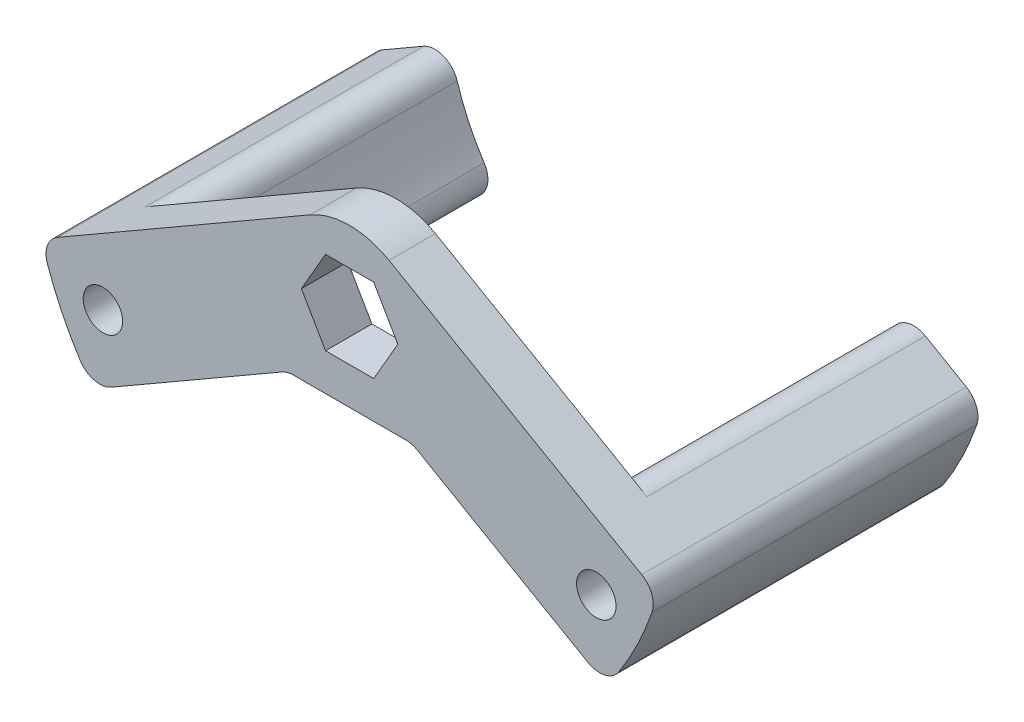
from build123d import *

# Parameters (mm, degrees)
PLATE_DEPTH  = 1
PILLAR_START = -7
PILLAR_DEPTH = 7
CUT_DEPTH    = 12.862454801607791
HOLESKE_R    = 0.4249999999999999
HOLE_DEPTH   = 11.491832758845009
FILLET_2_R   = 0.5


with BuildPart() as part:
    # PlateSke → Plate (new body)
    with BuildSketch(Plane.XY):
        with BuildLine():
            Line((-4.829949748426477, -0.8255818721816728), (-0.8500000000000022, 1.472243186433545))
            ThreePointArc((-0.8500000000000022, 1.472243186433545), (1e-16, 1.7000000000000004), (0.8500000000000022, 1.472243186433545))
            Line((0.8500000000000022, 1.472243186433545), (4.829949748426477, -0.8255818721816728))
            ThreePointArc((4.829949748426477, -0.8255818721816728), (3e-16, -4.899999999999999), (-4.829949748426477, -0.8255818721816728))
        make_face()
        Polygon((1.0392304845413274, 0), (0.5196152422706616, 0.9000000000000019), (-0.5196152422706678, 0.8999999999999982), (-1.0392304845413274, -7.26e-15), (-0.5196152422706553, -0.9000000000000056), (0.5196152422706742, -0.8999999999999948), align=None, mode=Mode.SUBTRACT)
    extrude(amount=PLATE_DEPTH)

    # PillarSke → Pillar (add)
    with BuildSketch(Plane.XY.offset(1).offset(PILLAR_START)):
        with BuildLine():
            Line((-6.641372894228101, -1.87140751302655), (-4.829949748426477, -0.8255818721816716))
            ThreePointArc((-4.829949748426477, -0.8255818721816716), (-1.88e-15, -4.899999999999999), (4.829949748426477, -0.8255818721816728))
            Line((4.829949748426477, -0.8255818721816728), (6.641372894228101, -1.8714075130265588))
            ThreePointArc((6.641372894228101, -1.8714075130265588), (-4.17e-15, -6.8999999999999995), (-6.641372894228101, -1.87140751302655))
        make_face()
    extrude(amount=PILLAR_DEPTH)

    # CutSke → Cut (cut, through all)
    with BuildSketch(Plane.XY.offset(1)):
        with BuildLine():
            Line((-1.3444863728671024, -1.7000000000000057), (1.3444863728670877, -1.700000000000006))
            Line((1.3444863728670877, -1.700000000000006), (5.53527589923164, -4.119553461163642))
            ThreePointArc((5.53527589923164, -4.119553461163642), (-2.64e-15, -6.899999999999998), (-5.5352758992316415, -4.119553461163638))
            Line((-5.5352758992316415, -4.119553461163638), (-1.3444863728671024, -1.7000000000000057))
        make_face()
    extrude(amount=-CUT_DEPTH, mode=Mode.SUBTRACT)

    # HoleSke → Hole (cut, through all)
    with BuildSketch(Plane(origin=(0, 0, -6), x_dir=(-1, 0, 0), z_dir=(0, 0, -1))):
        with Locations((-5.317327275986198, -2.5381645669665653)):
            Circle(HOLESKE_R)
        with Locations(Location((5.317327275986198, -2.5381645669665653, 0), (0, 0, 180))):
            Circle(HOLESKE_R)
    extrude(amount=-HOLE_DEPTH, mode=Mode.SUBTRACT)

    # Fillet 2
    fillet_2_edges = [part.edges().sort_by_distance(p)[0] for p in [
        (-4.829949748426477, -0.8255818721816717, -3),
        (6.641372894228101, -1.8714075130265588, -2.5),
        (-6.641372894228101, -1.8714075130265502, -2.5),
        (4.829949748426477, -0.8255818721816734, -3),
        (-1.3444863728671024, -1.7000000000000057, 0.5),
        (-5.535275899231642, -4.119553461163638, -2.5),
        (1.3444863728670877, -1.700000000000006, 0.5),
        (-3.7865857210858582, -3.1099467160819145, -3),
        (3.7865857210858542, -3.1099467160819194, -3),
        (5.535275899231641, -4.119553461163642, -2.5),
    ]]
    fillet(fillet_2_edges, radius=FILLET_2_R)


solid = part.part
